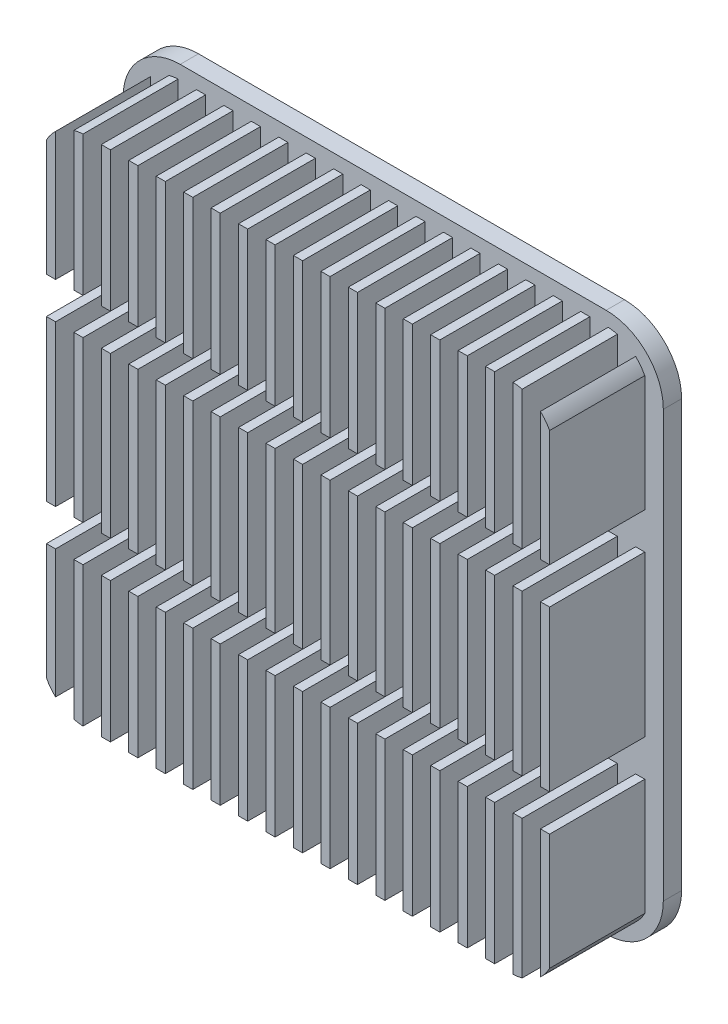
from build123d import *

# Parameters (mm, degrees)
BOSS_EXTRUDE1_DEPTH = 1.016
SKETCH3_W           = 0.508
SKETCH3_H           = 29
BOSS_EXTRUDE2_DEPTH = 5.2840001
SKETCH5_OUTSIDE_W   = 40.578
SKETCH5_OUTSIDE_H   = 40.578
CUT_EXTRUDE1_DEPTH  = 5.2840001
SKETCH8_W           = 32.248483867
SKETCH8_H           = 2.032
CUT_EXTRUDE2_DEPTH  = 5.2840001


with BuildPart() as part:
    # Sketch2 → Boss-Extrude1 (new body)
    with BuildSketch(Plane.XY):
        with BuildLine():
            Line((-15, 11.825), (-15, -11.825))
            ThreePointArc((-15, -11.825), (-14.07006403, -14.07006403), (-11.825, -15))
            Line((-11.825, -15), (11.825, -15))
            ThreePointArc((11.825, -15), (14.07006403, -14.07006403), (15, -11.825))
            Line((15, -11.825), (15, 11.825))
            ThreePointArc((15, 11.825), (14.07006403, 14.07006403), (11.825, 15))
            Line((11.825, 15), (-11.825, 15))
            ThreePointArc((-11.825, 15), (-14.07006403, 14.07006403), (-15, 11.825))
        make_face()
    extrude(amount=BOSS_EXTRUDE1_DEPTH)

    # Sketch3 → Boss-Extrude2 (add)
    with BuildSketch(Plane.XY.offset(1.016)):
        Rectangle(SKETCH3_W, SKETCH3_H)
        with Locations((1.524, 0)):
            Rectangle(SKETCH3_W, SKETCH3_H)
        with Locations((3.048, 0)):
            Rectangle(SKETCH3_W, SKETCH3_H)
        with Locations((4.572, 0)):
            Rectangle(SKETCH3_W, SKETCH3_H)
        with Locations((6.096, 0)):
            Rectangle(SKETCH3_W, SKETCH3_H)
        with Locations((7.62, 0)):
            Rectangle(SKETCH3_W, SKETCH3_H)
        with Locations((9.144, 0)):
            Rectangle(SKETCH3_W, SKETCH3_H)
        with Locations((10.668, 0)):
            Rectangle(SKETCH3_W, SKETCH3_H)
        with Locations((12.192, 0)):
            Rectangle(SKETCH3_W, SKETCH3_H)
        with Locations((13.716, 0)):
            Rectangle(SKETCH3_W, SKETCH3_H)
        with Locations((-1.524, 0)):
            Rectangle(SKETCH3_W, SKETCH3_H)
        with Locations((-3.048, 0)):
            Rectangle(SKETCH3_W, SKETCH3_H)
        with Locations((-4.572, 0)):
            Rectangle(SKETCH3_W, SKETCH3_H)
        with Locations((-6.096, 0)):
            Rectangle(SKETCH3_W, SKETCH3_H)
        with Locations((-7.62, 0)):
            Rectangle(SKETCH3_W, SKETCH3_H)
        with Locations((-9.144, 0)):
            Rectangle(SKETCH3_W, SKETCH3_H)
        with Locations((-10.668, 0)):
            Rectangle(SKETCH3_W, SKETCH3_H)
        with Locations((-12.192, 0)):
            Rectangle(SKETCH3_W, SKETCH3_H)
        with Locations((-13.716, 0)):
            Rectangle(SKETCH3_W, SKETCH3_H)
    extrude(amount=BOSS_EXTRUDE2_DEPTH)

    # Sketch5 outside → Cut-Extrude1 (cut)
    with BuildSketch(Plane.XY.offset(6.3000001)):
        Rectangle(SKETCH5_OUTSIDE_W, SKETCH5_OUTSIDE_H)
        with BuildLine():
            Line((-14.238, 11.825), (-14.238, -11.825))
            ThreePointArc((-14.238, -11.825), (-13.531248663, -13.531248663), (-11.825, -14.238))
            Line((-11.825, -14.238), (11.825, -14.238))
            ThreePointArc((11.825, -14.238), (13.531248663, -13.531248663), (14.238, -11.825))
            Line((14.238, -11.825), (14.238, 11.825))
            ThreePointArc((14.238, 11.825), (13.531248663, 13.531248663), (11.825, 14.238))
            Line((11.825, 14.238), (-11.825, 14.238))
            ThreePointArc((-11.825, 14.238), (-13.531248663, 13.531248663), (-14.238, 11.825))
        make_face(mode=Mode.SUBTRACT)
    extrude(amount=-CUT_EXTRUDE1_DEPTH, mode=Mode.SUBTRACT)

    # Sketch8 → Cut-Extrude2 (cut)
    with BuildSketch(Plane.XY.offset(6.3000001)):
        with Locations((-0.229229702, -5.461)):
            Rectangle(SKETCH8_W, SKETCH8_H)
        with Locations((-0.229229702, 5.461)):
            Rectangle(SKETCH8_W, SKETCH8_H)
    extrude(amount=-CUT_EXTRUDE2_DEPTH, mode=Mode.SUBTRACT)


solid = part.part
